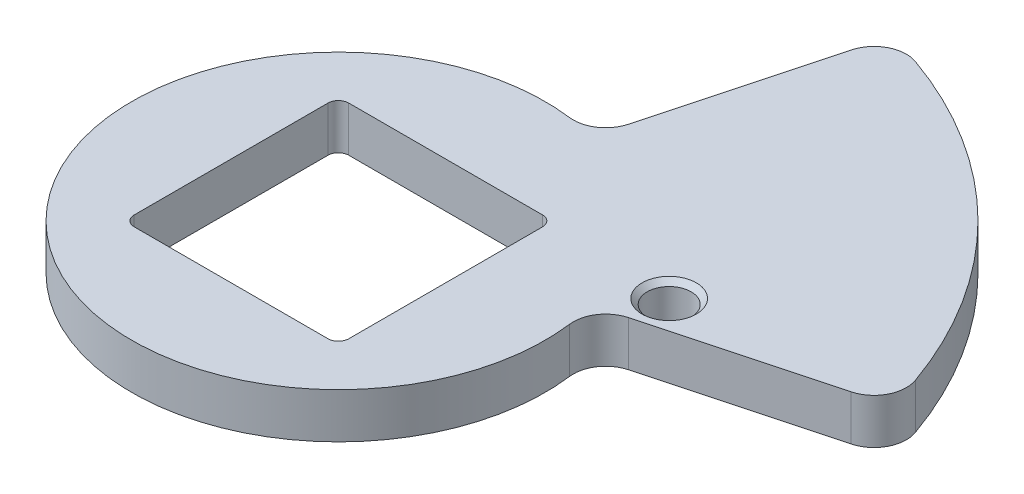
from build123d import *

# Parameters (mm, degrees)
CROQUIS1_R              = 2.159
CROQUIS1_W              = 21.082
CROQUIS1_H              = 21.082
SALIENTE_EXTRUIR1_DEPTH = 4.445
REDONDEO1_R             = 3.175
REDONDEO2_R             = 1.016
CHAFL_N1_SIZE           = 0.508


with BuildPart() as part:
    # Croquis1 → Saliente-Extruir1 (new body)
    with BuildSketch(Plane(origin=(0, 0, 0), x_dir=(1, 0, 0), z_dir=(0, 1, 0))):
        with BuildLine():
            Line((11.504506555, 42.935402979), (5.259202996, 19.62761279))
            ThreePointArc((5.259202996, 19.62761279), (-14.368409794, -14.368409794), (19.62761279, 5.259202996))
            Line((19.62761279, 5.259202996), (42.935402979, 11.504506555))
            ThreePointArc((42.935402979, 11.504506555), (31.430896424, 31.430896424), (11.504506555, 42.935402979))
        make_face()
        with Locations(Location((22.86, 9.652, 0), (0, 0, 270))):
            Circle(CROQUIS1_R, mode=Mode.SUBTRACT)
        Rectangle(CROQUIS1_W, CROQUIS1_H, mode=Mode.SUBTRACT)
    extrude(amount=SALIENTE_EXTRUIR1_DEPTH)

    # Redondeo1
    redondeo1_edges = [part.edges().sort_by_distance(p)[0] for p in [
        (42.935402979, 2.2225, -11.504506555),
        (19.62761279, 2.2225, -5.259202996),
        (5.259202996, 2.2225, -19.62761279),
        (11.504506555, 2.2225, -42.935402979),
    ]]
    fillet(redondeo1_edges, radius=REDONDEO1_R)

    # Redondeo2
    redondeo2_edges = [part.edges().sort_by_distance(p)[0] for p in [
        (10.541, 2.2225, 10.541),
        (10.541, 2.2225, -10.541),
        (-10.541, 2.2225, -10.541),
        (-10.541, 2.2225, 10.541),
    ]]
    fillet(redondeo2_edges, radius=REDONDEO2_R)

    # Chaflán1
    chafl_n1_edges = [part.edges().sort_by_distance(p)[0] for p in [
        (22.86, 0, -11.811),
        (22.86, 4.445, -11.811),
    ]]
    chamfer(chafl_n1_edges, length=CHAFL_N1_SIZE)


solid = part.part
